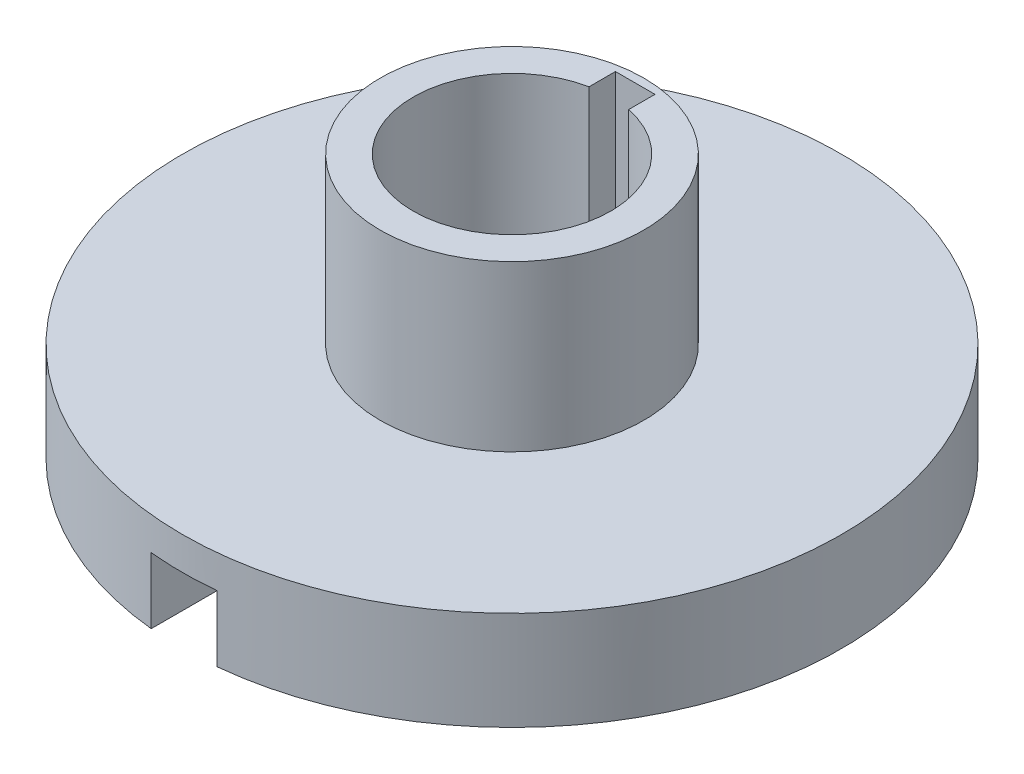
from build123d import *

# Parameters (mm, degrees)
SKETCH1_R           = 50
SKETCH1_R_2         = 20
BOSS_EXTRUDE1_DEPTH = 15
SKETCH1_3_R         = 20
BOSS_EXTRUDE2_DEPTH = 40
CUT_EXTRUDE1_DEPTH  = 10


with BuildPart() as part:
    # Sketch1 → Boss-Extrude1 (new body)
    with BuildSketch(Plane(origin=(0, 0, 0), x_dir=(1, 0, 0), z_dir=(0, 1, 0))):
        Circle(SKETCH1_R)
        Circle(SKETCH1_R_2, mode=Mode.SUBTRACT)
    extrude(amount=BOSS_EXTRUDE1_DEPTH)

    # Sketch1<3> → Boss-Extrude2 (add)
    with BuildSketch(Plane(origin=(0, 0, 0), x_dir=(1, 0, 0), z_dir=(0, 1, 0))):
        Circle(SKETCH1_3_R)
        with BuildLine():
            ThreePointArc((3, 14.696938457), (0, -15), (-3, 14.696938457))
            Line((-3, 14.696938457), (-3, 18.696938457))
            Line((-3, 18.696938457), (3, 18.696938457))
            Line((3, 18.696938457), (3, 14.696938457))
        make_face(mode=Mode.SUBTRACT)
    extrude(amount=BOSS_EXTRUDE2_DEPTH)

    # Sketch2 → Cut-Extrude1 (cut)
    with BuildSketch(Plane.XZ):
        with BuildLine():
            Line((-5, 49.749371855), (-5, -49.749371855))
            ThreePointArc((-5, -49.749371855), (0, -50), (5, -49.749371855))
            Line((5, -49.749371855), (5, 49.749371855))
            ThreePointArc((5, 49.749371855), (0, 50), (-5, 49.749371855))
        make_face()
    extrude(amount=-CUT_EXTRUDE1_DEPTH, mode=Mode.SUBTRACT)


solid = part.part
